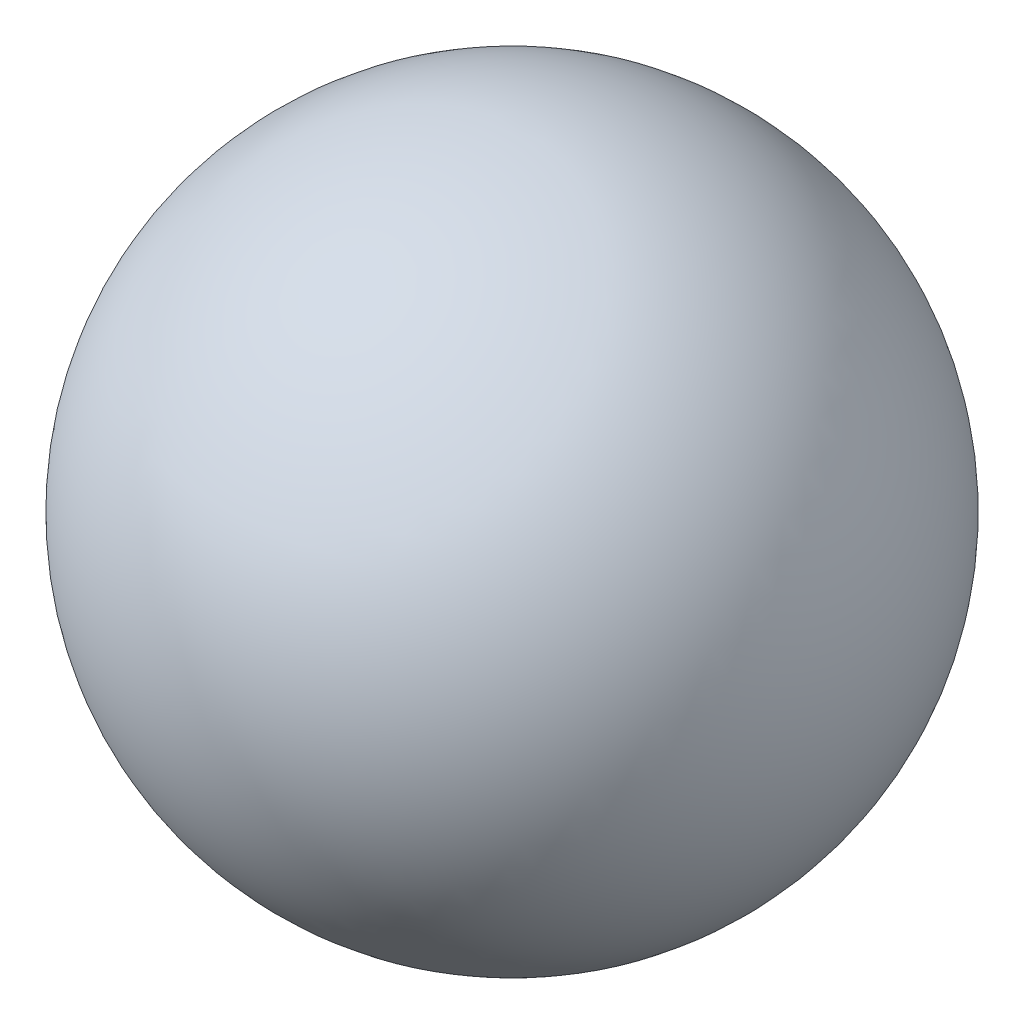
from build123d import *


with BuildPart() as part:
    # Sketch1 → Revolve2 (revolve)
    with BuildSketch(Plane.XY):
        with BuildLine():
            Line((0, 45), (0, 42))
            ThreePointArc((0, 42), (42, 0), (0, -42))
            Line((0, -42), (0, -45))
            ThreePointArc((0, -45), (45, 0), (0, 45))
        make_face()
    revolve(axis=Axis((0, 45, 0), (0, -1, 0)))


solid = part.part
